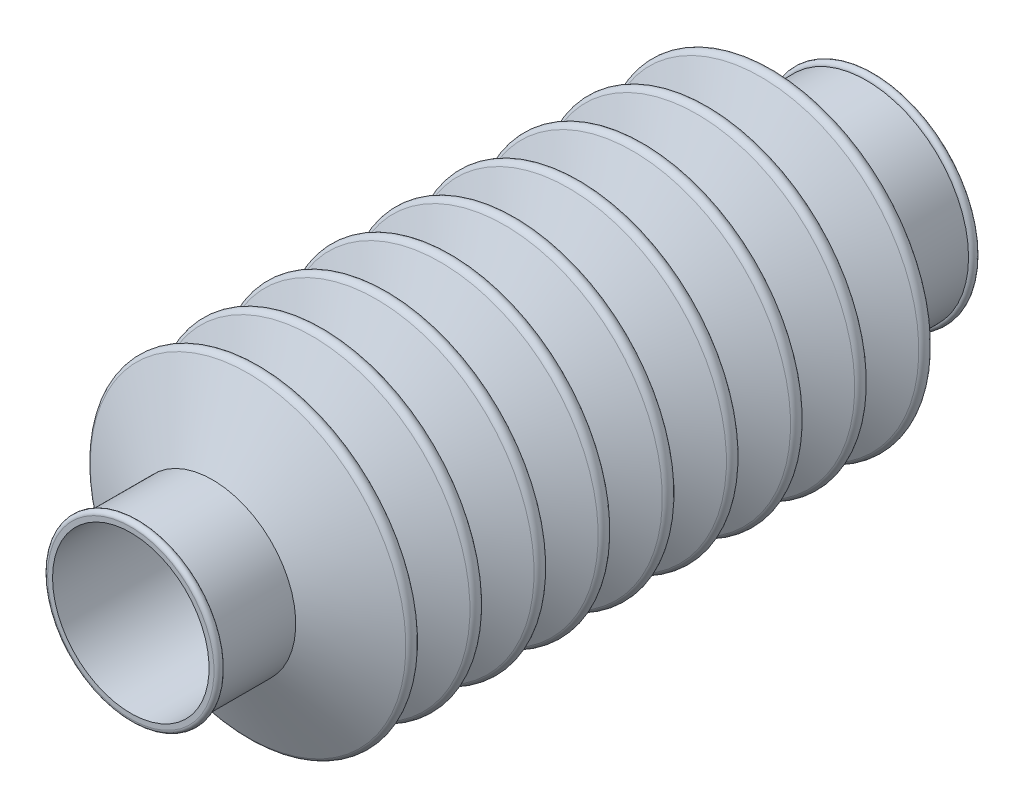
from build123d import *


with BuildPart() as part:
    # Sketch2 → Revolve1 (revolve)
    with BuildSketch(Plane(origin=(0, 0, 0), x_dir=(1, 0, 0), z_dir=(0, 1, 0)), mode=Mode.PRIVATE) as revolve1_sk:
        with BuildLine():
            Line((16.572325118, -15.076135556), (25.60112623, -10.777211216))
            ThreePointArc((25.60112623, -10.777211216), (26.171233796, -9.874331105), (25.60112623, -8.971450994))
            Line((25.60112623, -8.971450994), (16.572325118, -4.672526654))
            Line((16.572325118, -4.672526654), (25.60112623, -0.373602315))
            ThreePointArc((25.60112623, -0.373602315), (26.171233796, 0.529277797), (25.60112623, 1.432157908))
            Line((25.60112623, 1.432157908), (16.572325118, 5.731082248))
            Line((16.572325118, 5.731082248), (16.572325118, 16.731082248))
            ThreePointArc((16.572325118, 16.731082248), (17.206783994, 17.365541124), (16.572325118, 18))
            Line((16.572325118, 18), (15.875, 18))
            Line((15.875, 18), (15.875, -2.842350772))
            Line((15.875, -2.842350772), (12.7, -2.842350772))
            Line((12.7, -2.842350772), (12.7, -102.624238068))
            Line((12.7, -102.624238068), (13.5, -102.624238068))
            ThreePointArc((13.5, -102.624238068), (14.13, -101.994238068), (13.5, -101.364238068))
            Line((13.5, -101.364238068), (13.5, -89.364238068))
            Line((13.5, -89.364238068), (16.572325118, -87.901397868))
            Line((16.572325118, -87.901397868), (25.60112623, -83.602473528))
            ThreePointArc((25.60112623, -83.602473528), (26.171233796, -82.699593417), (25.60112623, -81.796713306))
            Line((25.60112623, -81.796713306), (16.572325118, -77.497788966))
            Line((16.572325118, -77.497788966), (25.60112623, -73.198864627))
            ThreePointArc((25.60112623, -73.198864627), (26.171233796, -72.295984515), (25.60112623, -71.393104404))
            Line((25.60112623, -71.393104404), (16.572325118, -67.094180065))
            Line((16.572325118, -67.094180065), (25.60112623, -62.795255725))
            ThreePointArc((25.60112623, -62.795255725), (26.171233796, -61.892375614), (25.60112623, -60.989495502))
            Line((25.60112623, -60.989495502), (16.572325118, -56.690571163))
            Line((16.572325118, -56.690571163), (25.60112623, -52.391646823))
            ThreePointArc((25.60112623, -52.391646823), (26.171233796, -51.488766712), (25.60112623, -50.585886601))
            Line((25.60112623, -50.585886601), (16.572325118, -46.286962261))
            Line((16.572325118, -46.286962261), (25.60112623, -41.988037921))
            ThreePointArc((25.60112623, -41.988037921), (26.171233796, -41.08515781), (25.60112623, -40.182277699))
            Line((25.60112623, -40.182277699), (16.572325118, -35.883353359))
            Line((16.572325118, -35.883353359), (25.60112623, -31.58442902))
            ThreePointArc((25.60112623, -31.58442902), (26.171233796, -30.681548909), (25.60112623, -29.778668797))
            Line((25.60112623, -29.778668797), (16.572325118, -25.479744458))
            Line((16.572325118, -25.479744458), (25.60112623, -21.180820118))
            ThreePointArc((25.60112623, -21.180820118), (26.171233796, -20.277940007), (25.60112623, -19.375059896))
            Line((25.60112623, -19.375059896), (16.572325118, -15.076135556))
        make_face()
    revolve(revolve1_sk.sketch.rotate(Axis((0, 0, -18), (0, 0, 1)), 180), axis=Axis((0, 0, -18), (0, 0, 1)))


solid = part.part
